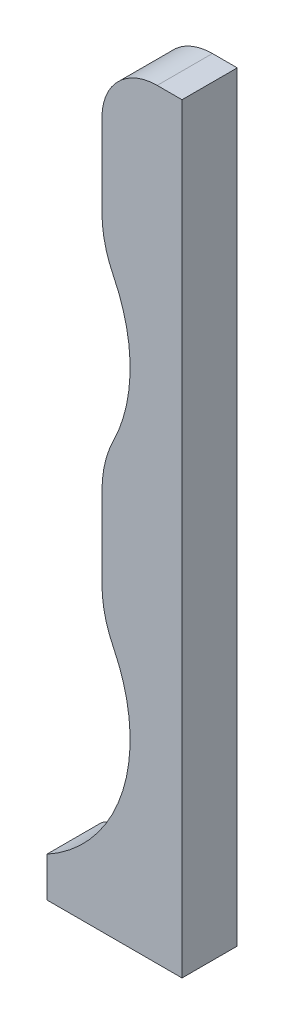
from build123d import *

# Parameters (mm, degrees)
BOSS_EXTRUDE1_DEPTH = 3.175


with BuildPart() as part:
    # Sketch1 → Boss-Extrude1 (new body)
    with BuildSketch(Plane.XY):
        with BuildLine():
            Line((3170.215202539, 2687.561172968), (3170.215202539, 2643.831916187))
            Line((3170.215202539, 2643.831916187), (3162.437951858, 2643.831916187))
            Line((3162.437951858, 2643.831916187), (3162.437951858, 2646.105339002))
            ThreePointArc((3162.437951858, 2646.105339002), (3166.805815961, 2651.440206281), (3166.271377044, 2658.314318641))
            ThreePointArc((3166.271377044, 2658.314318641), (3165.779748802, 2659.68421749), (3165.612951858, 2661.130073625))
            Line((3165.612951858, 2661.130073625), (3165.612951858, 2665.797353633))
            ThreePointArc((3165.612951858, 2665.797353633), (3165.779748802, 2667.243209769), (3166.271377044, 2668.613108618))
            ThreePointArc((3166.271377044, 2668.613108618), (3167.230702539, 2672.715663629), (3166.271377044, 2676.818218641))
            ThreePointArc((3166.271377044, 2676.818218641), (3165.779748802, 2678.18811749), (3165.612951858, 2679.633973625))
            Line((3165.612951858, 2679.633973625), (3165.612951858, 2684.386172968))
            ThreePointArc((3165.612951858, 2684.386172968), (3166.542887828, 2686.631236998), (3168.787951858, 2687.561172968))
            Line((3168.787951858, 2687.561172968), (3170.215202539, 2687.561172968))
        make_face()
    extrude(amount=BOSS_EXTRUDE1_DEPTH)


solid = part.part
